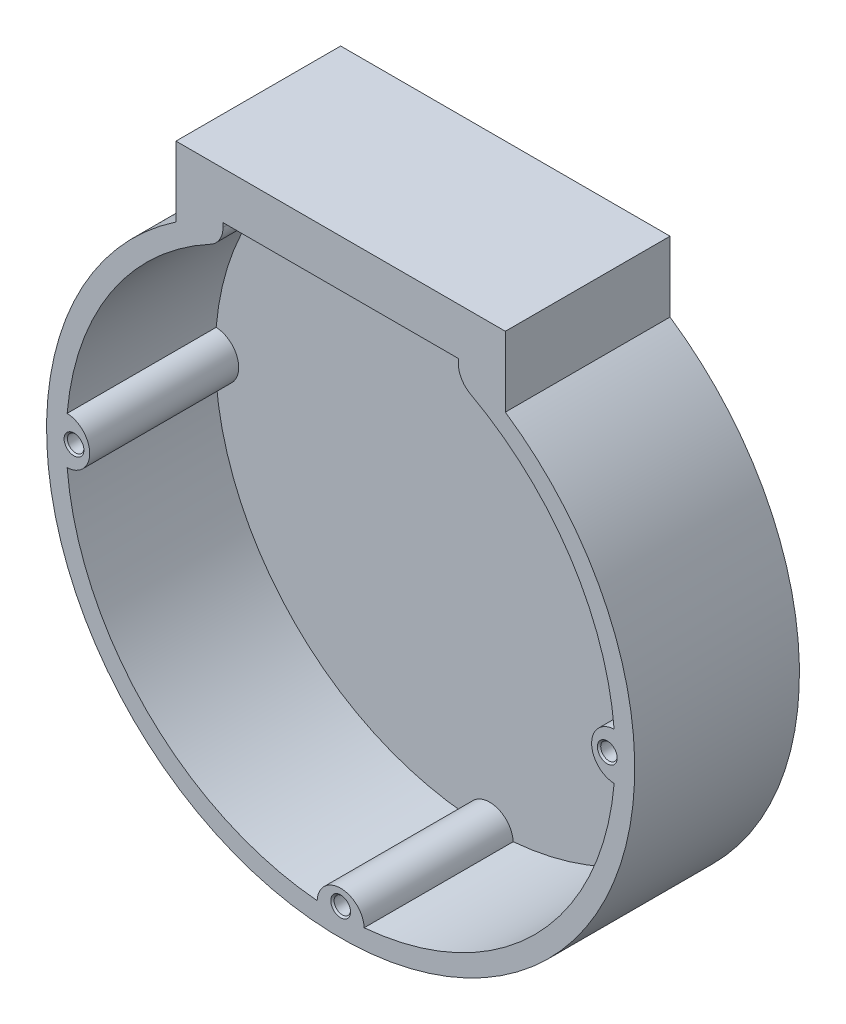
from build123d import *

# Parameters (mm, degrees)
EXTRUDE_1_DEPTH              = 42
CUT_EXTRUDE_1_DEPTH          = 38
HOLE_WIZARD_M5_1_D           = 4.2
HOLE_WIZARD_M5_1_CSINK_D     = 5.05
HOLE_WIZARD_M5_1_CSINK_ANGLE = 90
PATTERN_CIRCULAR_1_COUNT     = 4


with BuildPart() as part:
    # 草图1 → 凸台-拉伸1 (new body)
    with BuildSketch(Plane.XY):
        with BuildLine():
            Line((-42, 62.136945532), (-42, 80))
            Line((-42, 80), (42, 80))
            Line((42, 80), (42, 62.136945532))
            ThreePointArc((42, 62.136945532), (0, -75), (-42, 62.136945532))
        make_face()
    extrude(amount=EXTRUDE_1_DEPTH)

    # 草图2 → 切除-拉伸1 (cut)
    with BuildSketch(Plane.XY.offset(42)):
        with BuildLine():
            Line((-30, 66.932802123), (-30, 68))
            Line((-30, 68), (30, 68))
            Line((30, 68), (30, 66.932802123))
            ThreePointArc((30, 66.932802123), (30.849629548, 63.854867066), (33.157894737, 61.648633534))
            ThreePointArc((33.157894737, 61.648633534), (58.493479839, 38.451434516), (69.742857143, 5.994487263))
            ThreePointArc((69.742857143, 5.994487263), (64, 0), (69.742857143, -5.994487263))
            ThreePointArc((69.742857143, -5.994487263), (49.497474683, -49.497474683), (5.994487263, -69.742857143))
            ThreePointArc((5.994487263, -69.742857143), (0, -64), (-5.994487263, -69.742857143))
            ThreePointArc((-5.994487263, -69.742857143), (-49.497474683, -49.497474683), (-69.742857143, -5.994487263))
            ThreePointArc((-69.742857143, -5.994487263), (-64, 0), (-69.742857143, 5.994487263))
            ThreePointArc((-69.742857143, 5.994487263), (-58.493479839, 38.451434516), (-33.157894737, 61.648633534))
            ThreePointArc((-33.157894737, 61.648633534), (-30.849629548, 63.854867066), (-30, 66.932802123))
        make_face()
    extrude(amount=-CUT_EXTRUDE_1_DEPTH, mode=Mode.SUBTRACT)

    # M5 螺纹孔1 (through all)
    with Locations(Plane.XY.offset(42)):
        with Locations((0, -68)):
            hole_wizard_m5_1 = CounterSinkHole(HOLE_WIZARD_M5_1_D / 2, HOLE_WIZARD_M5_1_CSINK_D / 2, counter_sink_angle=HOLE_WIZARD_M5_1_CSINK_ANGLE)

    # 阵列(圆周)1: M5 螺纹孔1 ×4 about axis, 1 skipped
    pattern_circular_1_axis = Axis((0, 0, 0), (0, 0, -1))
    add([hole_wizard_m5_1.rotate(pattern_circular_1_axis, i * 360 / PATTERN_CIRCULAR_1_COUNT) for i in range(1, PATTERN_CIRCULAR_1_COUNT) if i not in (2,)], mode=Mode.SUBTRACT)


solid = part.part
